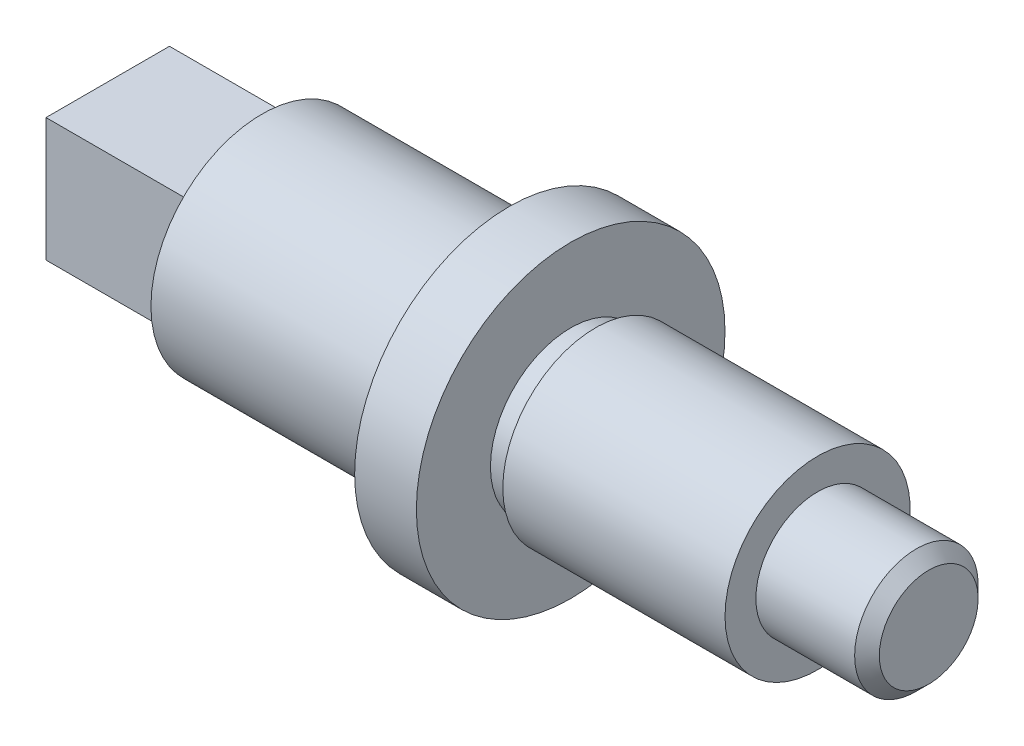
from build123d import *

# Parameters (mm, degrees)
SKIZZE2_W                       = 20
SKIZZE2_H                       = 20
AUFSATZ_LINEAR_AUSTRAGEN1_DEPTH = 25


with BuildPart() as part:
    # Skizze1 → Rotation1 (revolve)
    with BuildSketch(Plane.XY, mode=Mode.PRIVATE) as rotation1_sk:
        with BuildLine():
            Line((18.187375951, 0), (18.187375951, -18))
            Line((18.187375951, -18), (54.187375951, -18))
            ThreePointArc((54.187375951, -18), (57.015803076, -19.171572875), (58.187375951, -22))
            Line((58.187375951, -22), (58.187375951, -25))
            Line((58.187375951, -25), (68.187375951, -25))
            Line((68.187375951, -25), (68.187375951, -13))
            Line((68.187375951, -13), (72.187375951, -13))
            Line((72.187375951, -13), (72.187375951, -15))
            Line((72.187375951, -15), (108.187375951, -15))
            Line((108.187375951, -15), (108.187375951, -10))
            Line((108.187375951, -10), (124.187375951, -10))
            Line((124.187375951, -10), (126.187375951, -8))
            Line((126.187375951, -8), (126.187375951, 0))
            Line((126.187375951, 0), (18.187375951, 0))
        make_face()
    revolve(rotation1_sk.sketch.rotate(Axis((0, 0, 0), (1, 0, 0)), 270), axis=Axis((0, 0, 0), (1, 0, 0)))

    # Skizze2 → Aufsatz-Linear austragen1 (add)
    with BuildSketch(Plane.ZY.offset(-18.187375951)):
        Rectangle(SKIZZE2_W, SKIZZE2_H)
    extrude(amount=AUFSATZ_LINEAR_AUSTRAGEN1_DEPTH)


solid = part.part
